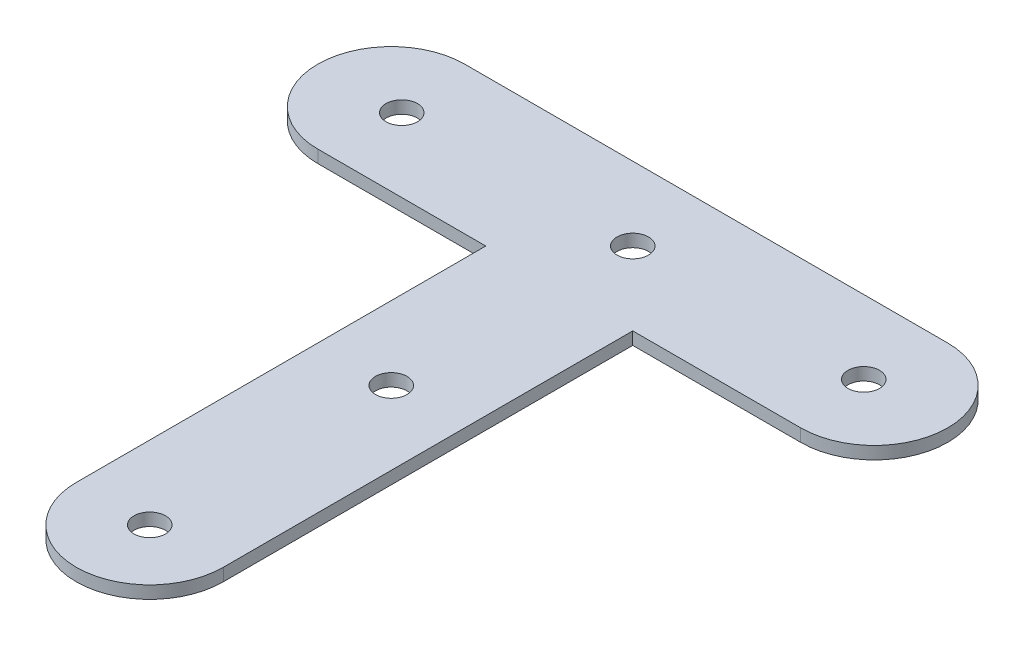
from build123d import *

# Parameters (mm, degrees)
SKETCH_1_R      = 1.5
EXTRUDE_1_DEPTH = 1.2


with BuildPart() as part:
    # 草图1 → 凸台-拉伸1 (new body)
    with BuildSketch(Plane(origin=(0, 0, 0), x_dir=(1, 0, 0), z_dir=(0, 1, 0))):
        with BuildLine():
            Line((-23, 7), (23, 7))
            ThreePointArc((23, 7), (30, 0), (23, -7))
            Line((23, -7), (7, -7))
            Line((7, -7), (7, -46))
            ThreePointArc((7, -46), (0, -53), (-7, -46))
            Line((-7, -46), (-7, -7))
            Line((-7, -7), (-23, -7))
            ThreePointArc((-23, -7), (-30, 0), (-23, 7))
        make_face()
        with Locations(Location((22, 0, 0), (0, 0, 270))):
            Circle(SKETCH_1_R, mode=Mode.SUBTRACT)
        with Locations(Location((-22, 0, 0), (0, 0, 270))):
            Circle(SKETCH_1_R, mode=Mode.SUBTRACT)
        with Locations(Location((0, 0, 0), (0, 0, 270))):
            Circle(SKETCH_1_R, mode=Mode.SUBTRACT)
        with Locations(Location((0, -23, 0), (0, 0, 270))):
            Circle(SKETCH_1_R, mode=Mode.SUBTRACT)
        with Locations(Location((0, -46, 0), (0, 0, 270))):
            Circle(SKETCH_1_R, mode=Mode.SUBTRACT)
    extrude(amount=EXTRUDE_1_DEPTH)


solid = part.part
